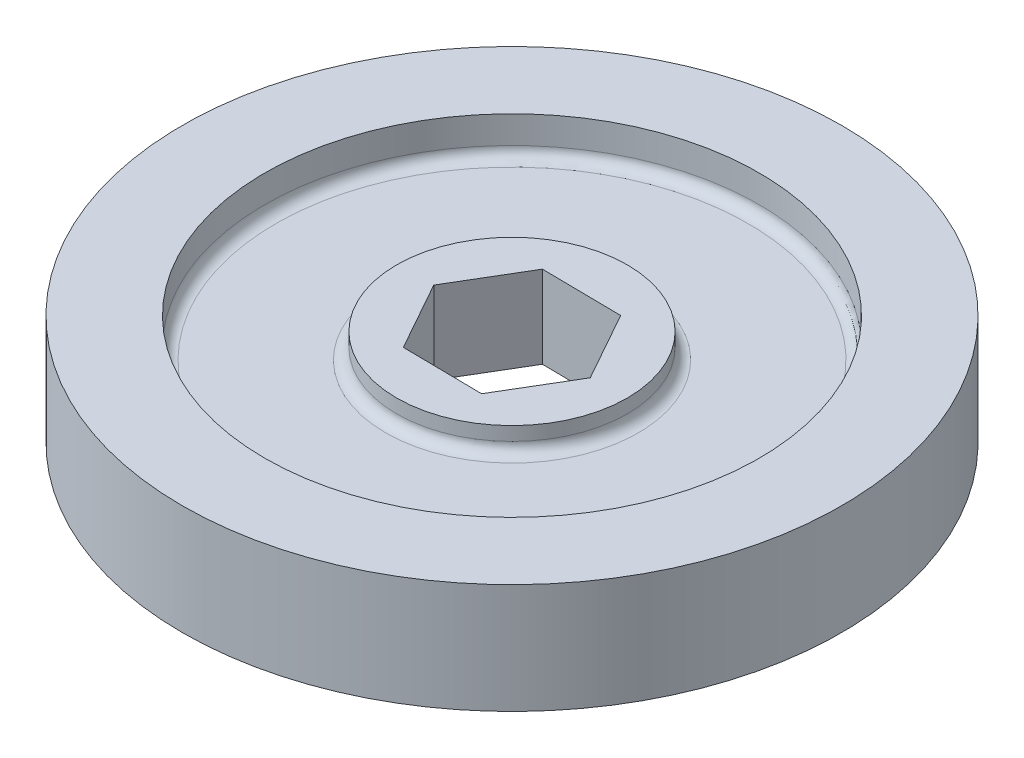
from build123d import *

# Parameters (mm, degrees)
SKETCH1_R               = 30
BOSS_EXTRUDE1_DEPTH     = 10
SKETCH2_R               = 22.5
CUT_EXTRUDE1_DEPTH      = 3.5
CUT_EXTRUDE2_START      = -3.5
SKETCH3_R               = 22.5
CUT_EXTRUDE2_DEPTH      = 3.5
SKETCH5_R               = 10.5
BOSS_EXTRUDE2_DEPTH     = 2.25
BOSS_EXTRUDE3_START     = 2.25
SKETCH6_R               = 10.5
BOSS_EXTRUDE3_DEPTH     = 2.25
CUT_EXTRUDE3_DEPTH      = 43.921439864
CUT_EXTRUDE3_DEPTH_BACK = 43.921439864
FILLET1_R               = 1
FILLET2_R               = 1


with BuildPart() as part:
    # Sketch1 → Boss-Extrude1 (new body)
    with BuildSketch(Plane(origin=(0, 0, 0), x_dir=(1, 0, 0), z_dir=(0, 1, 0))):
        with Locations(Location((0, 0, 0), (0, 0, 270))):
            Circle(SKETCH1_R)
    extrude(amount=BOSS_EXTRUDE1_DEPTH)

    # Sketch2 → Cut-Extrude1 (cut)
    with BuildSketch(Plane(origin=(0, 10, 0), x_dir=(1, 0, 0), z_dir=(0, 1, 0))):
        with Locations(Location((0, 0, 0), (0, 0, 270))):
            Circle(SKETCH2_R)
    extrude(amount=-CUT_EXTRUDE1_DEPTH, mode=Mode.SUBTRACT)

    # Sketch3 → Cut-Extrude2 (cut)
    with BuildSketch(Plane.XZ.offset(CUT_EXTRUDE2_START)):
        with Locations(Location((0, 0, 0), (0, 0, 90))):
            Circle(SKETCH3_R)
    extrude(amount=CUT_EXTRUDE2_DEPTH, mode=Mode.SUBTRACT)

    # Sketch5 → Boss-Extrude2 (add)
    with BuildSketch(Plane(origin=(0, 6.5, 0), x_dir=(1, 0, 0), z_dir=(0, 1, 0))):
        with Locations(Location((0, 0, 0), (0, 0, 270))):
            Circle(SKETCH5_R)
    extrude(amount=BOSS_EXTRUDE2_DEPTH)

    # Sketch6 → Boss-Extrude3 (add)
    with BuildSketch(Plane.XZ.offset(-3.5).offset(BOSS_EXTRUDE3_START)):
        with Locations(Location((0, 0, 0), (0, 0, 90))):
            Circle(SKETCH6_R)
    extrude(amount=-BOSS_EXTRUDE3_DEPTH)

    # Sketch4 → Cut-Extrude3 (cut, two sides: drawn at the far end of the back side and taken through both)
    with BuildSketch(Plane(origin=(0, 6.5, 0), x_dir=(1, 0, 0), z_dir=(0, 1, 0)).offset(-CUT_EXTRUDE3_DEPTH_BACK)):
        Polygon((3.689639098, 6.202410552), (-3.526625554, 6.296526466), (-7.216264652, 0.094115913), (-3.689639098, -6.202410552), (3.526625554, -6.296526466), (7.216264652, -0.094115913), align=None)
    extrude(amount=CUT_EXTRUDE3_DEPTH + CUT_EXTRUDE3_DEPTH_BACK, mode=Mode.SUBTRACT)

    # Fillet1
    fillet1_edges = [part.edges().sort_by_distance(p)[0] for p in [
        (0, 3.5, -22.5),
        (0, 6.5, -22.5),
    ]]
    fillet(fillet1_edges, radius=FILLET1_R)

    # Fillet2
    fillet2_edges = [part.edges().sort_by_distance(p)[0] for p in [
        (0, 6.5, -10.5),
        (0, 3.5, -10.5),
    ]]
    fillet(fillet2_edges, radius=FILLET2_R)


solid = part.part
